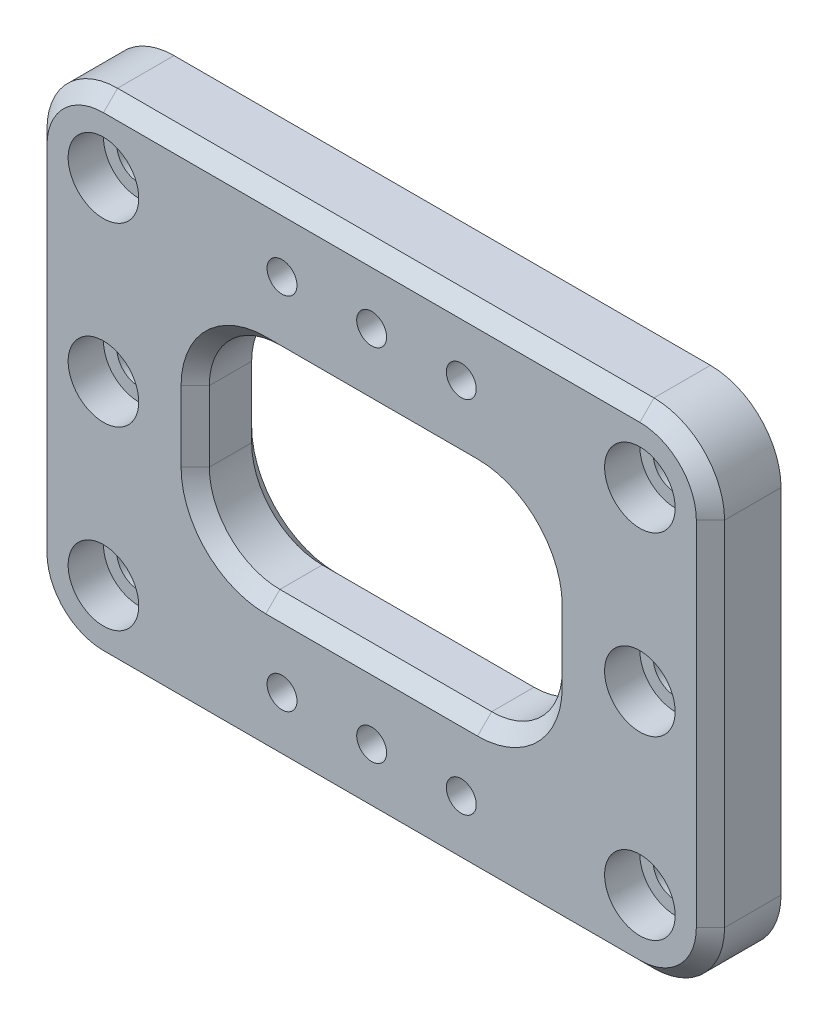
from build123d import *

# Parameters (mm, degrees)
SKETCH_1_W          = 96
SKETCH_1_H          = 70
EXTRUDE_1_DEPTH     = 10
FILLET_1_R          = 10
SKETCH_2_R          = 2.12
CUT_EXTRUDE_1_DEPTH = 10
SKETCH_3_R          = 5
CUT_EXTRUDE_2_DEPTH = 5
SKETCH_4_R          = 3.1
CUT_EXTRUDE_3_DEPTH = 5
CHAMFER_1_SIZE      = 1
CHAMFER_2_SIZE      = 2
SKETCH_5_W          = 50
SKETCH_5_H          = 30
CUT_EXTRUDE_4_DEPTH = 10
FILLET_2_R          = 10
CHAMFER_3_SIZE      = 2


with BuildPart() as part:
    # 草图1 → 凸台-拉伸1 (new body)
    with BuildSketch(Plane.XY):
        Rectangle(SKETCH_1_W, SKETCH_1_H)
    extrude(amount=EXTRUDE_1_DEPTH)

    # 圆角1
    fillet_1_edges = [part.edges().sort_by_distance(p)[0] for p in [
        (48, -35, 5),
        (-48, -35, 5),
        (-48, 35, 5),
        (48, 35, 5),
    ]]
    fillet(fillet_1_edges, radius=FILLET_1_R)

    # 草图2 → 切除-拉伸1 (cut)
    with BuildSketch(Plane.XY.offset(10)):
        with Locations((0, 25.5)):
            Circle(SKETCH_2_R)
        with Locations((-12.7, 25.5)):
            Circle(SKETCH_2_R)
        with Locations(Location((12.7, 25.5, 0), (0, 0, 180))):
            Circle(SKETCH_2_R)
        with Locations((-12.7, -25.5)):
            Circle(SKETCH_2_R)
        with Locations((0, -25.5)):
            Circle(SKETCH_2_R)
        with Locations((12.7, -25.5)):
            Circle(SKETCH_2_R)
    extrude(amount=-CUT_EXTRUDE_1_DEPTH, mode=Mode.SUBTRACT)

    # 草图3 → 切除-拉伸2 (cut)
    with BuildSketch(Plane.XY.offset(10)):
        with Locations((-38, 25)):
            Circle(SKETCH_3_R)
        with Locations((-38, 0)):
            Circle(SKETCH_3_R)
        with Locations((-38, -25)):
            Circle(SKETCH_3_R)
        with Locations(Location((38, -25, 0), (0, 0, 180))):
            Circle(SKETCH_3_R)
        with Locations(Location((38, 0, 0), (0, 0, 180))):
            Circle(SKETCH_3_R)
        with Locations(Location((38, 25, 0), (0, 0, 180))):
            Circle(SKETCH_3_R)
    extrude(amount=-CUT_EXTRUDE_2_DEPTH, mode=Mode.SUBTRACT)

    # 草图4 → 切除-拉伸3 (cut)
    with BuildSketch(Plane.XY.offset(5)):
        with Locations((-38, 25)):
            Circle(SKETCH_4_R)
        with Locations((-38, 0)):
            Circle(SKETCH_4_R)
        with Locations((-38, -25)):
            Circle(SKETCH_4_R)
        with Locations((38, 25)):
            Circle(SKETCH_4_R)
        with Locations((38, 0)):
            Circle(SKETCH_4_R)
        with Locations((38, -25)):
            Circle(SKETCH_4_R)
    extrude(amount=-CUT_EXTRUDE_3_DEPTH, mode=Mode.SUBTRACT)

    # 倒角1
    chamfer_1_edges = [part.edges().sort_by_distance(p)[0] for p in [
        (34.9, 0, 0),
        (34.9, -25, 0),
        (-41.1, 25, 0),
        (-41.1, 0, 0),
        (-41.1, -25, 0),
        (34.9, 25, 0),
    ]]
    chamfer(chamfer_1_edges, length=CHAMFER_1_SIZE)

    # 倒角2
    chamfer_2_edges = [part.edges().sort_by_distance(p)[0] for p in [
        (0, 35, 10),
        (48, 0, 10),
        (-48, 0, 10),
        (0, -35, 10),
        (-45.071067812, -32.071067812, 10),
        (45.071067812, -32.071067812, 10),
        (-45.071067812, 32.071067812, 10),
        (45.071067812, 32.071067812, 10),
    ]]
    chamfer(chamfer_2_edges, length=CHAMFER_2_SIZE)

    # 草图5 → 切除-拉伸4 (cut)
    with BuildSketch(Plane.XY.offset(10)):
        Rectangle(SKETCH_5_W, SKETCH_5_H)
    extrude(amount=-CUT_EXTRUDE_4_DEPTH, mode=Mode.SUBTRACT)

    # 圆角2
    fillet_2_edges = [part.edges().sort_by_distance(p)[0] for p in [
        (25, 15, 5),
        (25, -15, 5),
        (-25, -15, 5),
        (-25, 15, 5),
    ]]
    fillet(fillet_2_edges, radius=FILLET_2_R)

    # 倒角3
    chamfer_3_edges = [part.edges().sort_by_distance(p)[0] for p in [
        (25, 0, 10),
        (25, 0, 0),
        (0, -15, 10),
        (0, -15, 0),
        (0, 15, 10),
        (0, 15, 0),
        (-25, 0, 10),
        (-25, 0, 0),
        (22.071067812, -12.071067812, 10),
        (22.071067812, -12.071067812, 0),
        (22.071067812, 12.071067812, 10),
        (22.071067812, 12.071067812, 0),
        (-22.071067812, -12.071067812, 10),
        (-22.071067812, -12.071067812, 0),
        (-22.071067812, 12.071067812, 10),
        (-22.071067812, 12.071067812, 0),
    ]]
    chamfer(chamfer_3_edges, length=CHAMFER_3_SIZE)


solid = part.part
